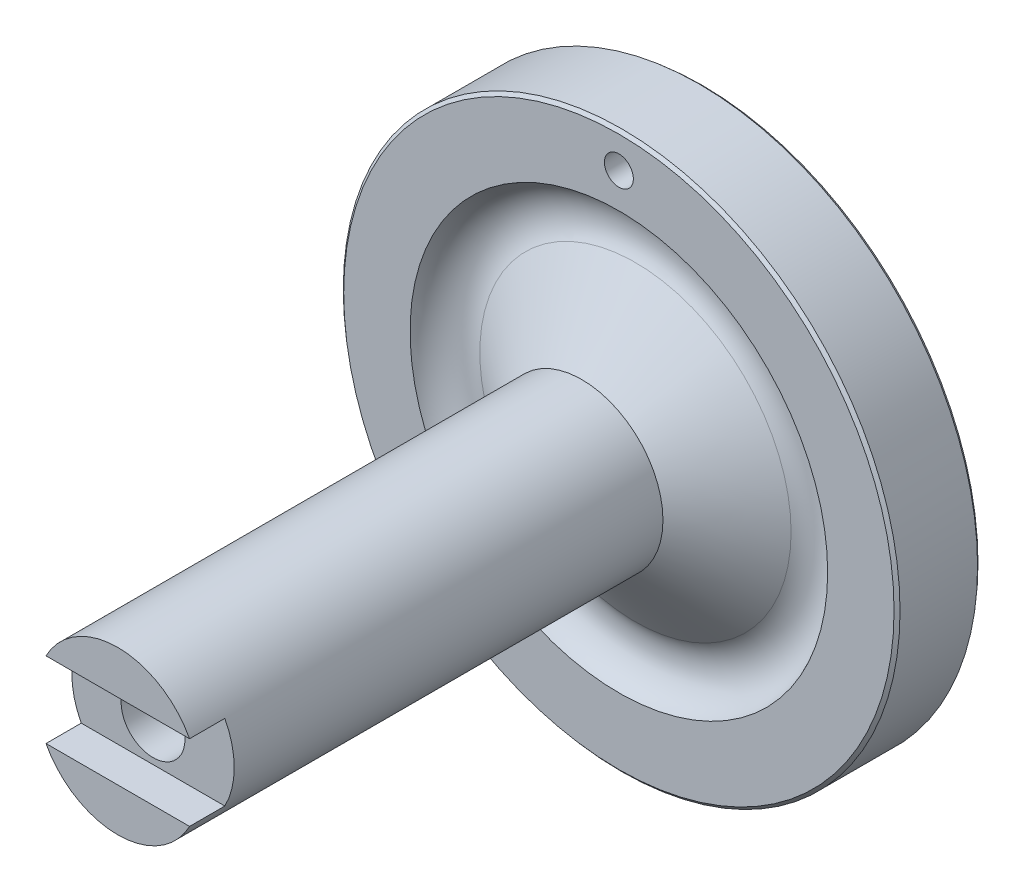
from build123d import *
from OCP.BRepFilletAPI import BRepFilletAPI_MakeChamfer

# Parameters (mm, degrees)
CHAMFER1_SIZE           = 0.762
CHAMFER1_SIZE2          = 0.876580726
CUT_EXTRUDE1_DEPTH      = 193.922990854
CUT_EXTRUDE1_DEPTH_BACK = 193.922990854
SKETCH2_W               = 9.652
SKETCH2_H               = 20.7772
SKETCH3_R               = 3.9624
CUT_EXTRUDE2_DEPTH      = 193.922990854


with BuildPart() as part:
    # Sketch1 → Revolve1 (revolve)
    with BuildSketch(Plane(origin=(0, 0, 0), x_dir=(0, 0, -1), z_dir=(1, 0, 0)), mode=Mode.PRIVATE) as revolve1_sk:
        with BuildLine():
            Line((0, 8.7376), (0, 22.225))
            Line((0, 22.225), (127, 22.225))
            Line((127, 22.225), (141.697599691, 42.602209504))
            ThreePointArc((141.697599691, 42.602209504), (143.065361481, 51.010384281), (137.16, 57.15))
            Line((137.16, 57.15), (137.16, 76.2))
            Line((137.16, 76.2), (160.02, 76.2))
            Line((160.02, 76.2), (160.02, 57.15))
            Line((160.02, 57.15), (144.145832257, 35.141559942))
            ThreePointArc((144.145832257, 35.141559942), (142.376686305, 28.805838284), (145.135826502, 22.834373498))
            Line((145.135826502, 22.834373498), (152.0952, 15.875))
            Line((152.0952, 15.875), (152.0952, 8.7376))
            Line((152.0952, 8.7376), (0, 8.7376))
        make_face()
    revolve(revolve1_sk.sketch.rotate(Axis((0, 0, 0), (0, 0, -1)), 90), axis=Axis((0, 0, 0), (0, 0, -1)))

    # Chamfer1: one chamfer whose edges measure the first distance from different faces: ONE call of the kernel's chamfer builder (chamfer() names one face for all edges)
    chamfer1_edges_1 = [part.edges().sort_by_distance(p)[0] for p in [
        (-76.2, 0, -160.02),
    ]]
    chamfer1_side_1 = [part.faces().sort_by_distance(p)[0] for p in [
        (-74.044738531, 0, -160.02),
    ]]
    chamfer1_edges_2 = [part.edges().sort_by_distance(p)[0] for p in [
        (-76.2, 0, -137.16),
    ]]
    chamfer1_side_2 = [part.faces().sort_by_distance(p)[0] for p in [
        (-76.2, 0, -148.59),
    ]]
    chamfer1 = BRepFilletAPI_MakeChamfer(part.part.solid().wrapped)
    for e in chamfer1_edges_1:
        chamfer1.Add(CHAMFER1_SIZE, CHAMFER1_SIZE2, e.wrapped, chamfer1_side_1[0].wrapped)  # the first distance lies on this face
    for e in chamfer1_edges_2:
        chamfer1.Add(CHAMFER1_SIZE, CHAMFER1_SIZE2, e.wrapped, chamfer1_side_2[0].wrapped)  # the first distance lies on this face
    add(Compound.cast(chamfer1.Shape()), mode=Mode.REPLACE)

    # Sketch2 → Cut-Extrude1 (cut, two sides: drawn at the far end of the back side and taken through both)
    with BuildSketch(Plane(origin=(0, 0, 0), x_dir=(0, 0, -1), z_dir=(1, 0, 0)).offset(-CUT_EXTRUDE1_DEPTH_BACK)):
        with Locations((4.826, 0)):
            Rectangle(SKETCH2_W, SKETCH2_H)
    extrude(amount=CUT_EXTRUDE1_DEPTH + CUT_EXTRUDE1_DEPTH_BACK, mode=Mode.SUBTRACT)

    # Sketch3 → Cut-Extrude2 (cut, through all)
    with BuildSketch(Plane(origin=(0, 0, -160.02), x_dir=(-1, 0, 0), z_dir=(0, 0, -1))):
        with Locations((0, 66.675)):
            Circle(SKETCH3_R)
    extrude(amount=-CUT_EXTRUDE2_DEPTH, mode=Mode.SUBTRACT)


solid = part.part
